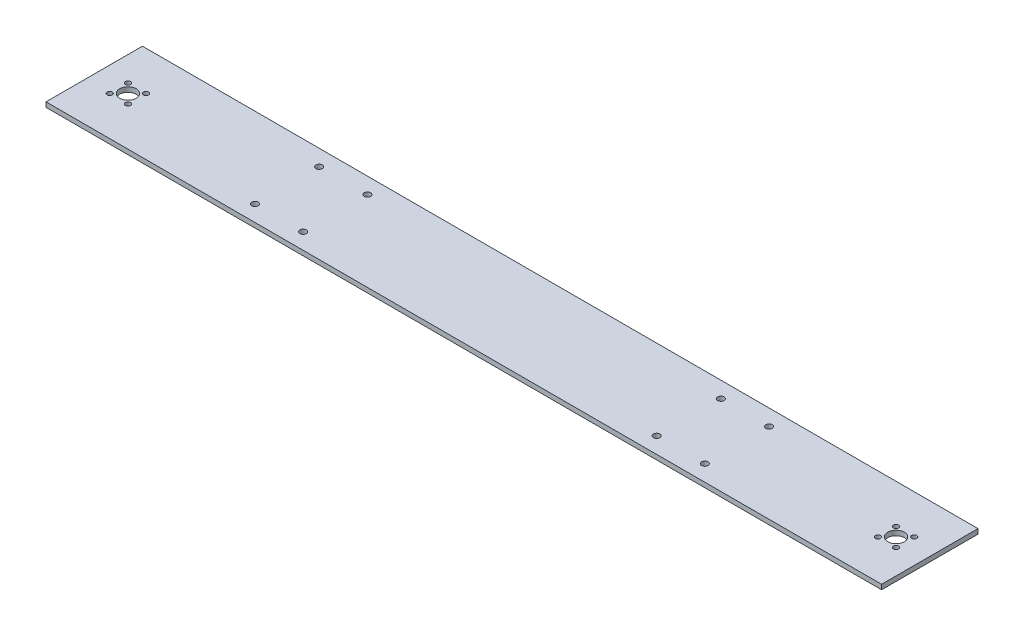
from build123d import *

# Parameters (mm, degrees)
SZKIC1_W                    = 520
SZKIC1_H                    = 60
DODANIE_WYCI_GNI_CIE1_DEPTH = 3
OTW_R_POD_RUB_M41_D         = 4
SZKIC8_R                    = 5.15
WYTNIJ_WYCI_GNI_CIE1_DEPTH  = 10
SZKIC9_R                    = 1.6
WYTNIJ_WYCI_GNI_CIE2_DEPTH  = 524.45868987
SZKIC10_R                   = 1.6
WYTNIJ_WYCI_GNI_CIE3_DEPTH  = 10


with BuildPart() as part:
    # Szkic1 → Dodanie-wyciągnięcie1 (new body)
    with BuildSketch(Plane(origin=(0, 0, 0), x_dir=(1, 0, 0), z_dir=(0, 1, 0))):
        with Locations((-260, 30)):
            Rectangle(SZKIC1_W, SZKIC1_H)
    extrude(amount=DODANIE_WYCI_GNI_CIE1_DEPTH)

    # Otwór pod śrubę M41 (through all)
    with Locations(Plane(origin=(0, 3, 0), x_dir=(1, 0, 0), z_dir=(0, 1, 0))):
        with Locations((-400, 50), (-370, 50), (-400, 10), (-370, 10), (-150, 50), (-120, 50), (-150, 10), (-120, 10)):
            Hole(OTW_R_POD_RUB_M41_D / 2)

    # Szkic8 → Wytnij-wyciągnięcie1 (cut)
    with BuildSketch(Plane(origin=(0, 3, 0), x_dir=(1, 0, 0), z_dir=(0, 1, 0))):
        with Locations(Location((-21, 30, 0), (0, 0, 270))):
            Circle(SZKIC8_R)
        with Locations(Location((-499, 30, 0), (0, 0, 270))):
            Circle(SZKIC8_R)
    extrude(amount=-WYTNIJ_WYCI_GNI_CIE1_DEPTH, mode=Mode.SUBTRACT)

    # Szkic9 → Wytnij-wyciągnięcie2 (cut, through all)
    with BuildSketch(Plane(origin=(0, 3, 0), x_dir=(1, 0, 0), z_dir=(0, 1, 0))):
        with Locations(Location((-504.65, 35.663700204, 0), (0, 0, 270))):
            Circle(SZKIC9_R)
        with Locations(Location((-493.336299796, 35.65, 0), (0, 0, 270))):
            Circle(SZKIC9_R)
        with Locations(Location((-493.35, 24.336299796, 0), (0, 0, 270))):
            Circle(SZKIC9_R)
        with Locations(Location((-504.663700204, 24.35, 0), (0, 0, 270))):
            Circle(SZKIC9_R)
    extrude(amount=-WYTNIJ_WYCI_GNI_CIE2_DEPTH, mode=Mode.SUBTRACT)

    # Szkic10 → Wytnij-wyciągnięcie3 (cut)
    with BuildSketch(Plane(origin=(0, 3, 0), x_dir=(1, 0, 0), z_dir=(0, 1, 0))):
        with Locations(Location((-15.35, 35.663700204, 0), (0, 0, 270))):
            Circle(SZKIC10_R)
        with Locations(Location((-15.336299796, 24.35, 0), (0, 0, 270))):
            Circle(SZKIC10_R)
        with Locations(Location((-26.65, 24.336299796, 0), (0, 0, 270))):
            Circle(SZKIC10_R)
        with Locations(Location((-26.663700204, 35.65, 0), (0, 0, 270))):
            Circle(SZKIC10_R)
    extrude(amount=-WYTNIJ_WYCI_GNI_CIE3_DEPTH, mode=Mode.SUBTRACT)


solid = part.part
